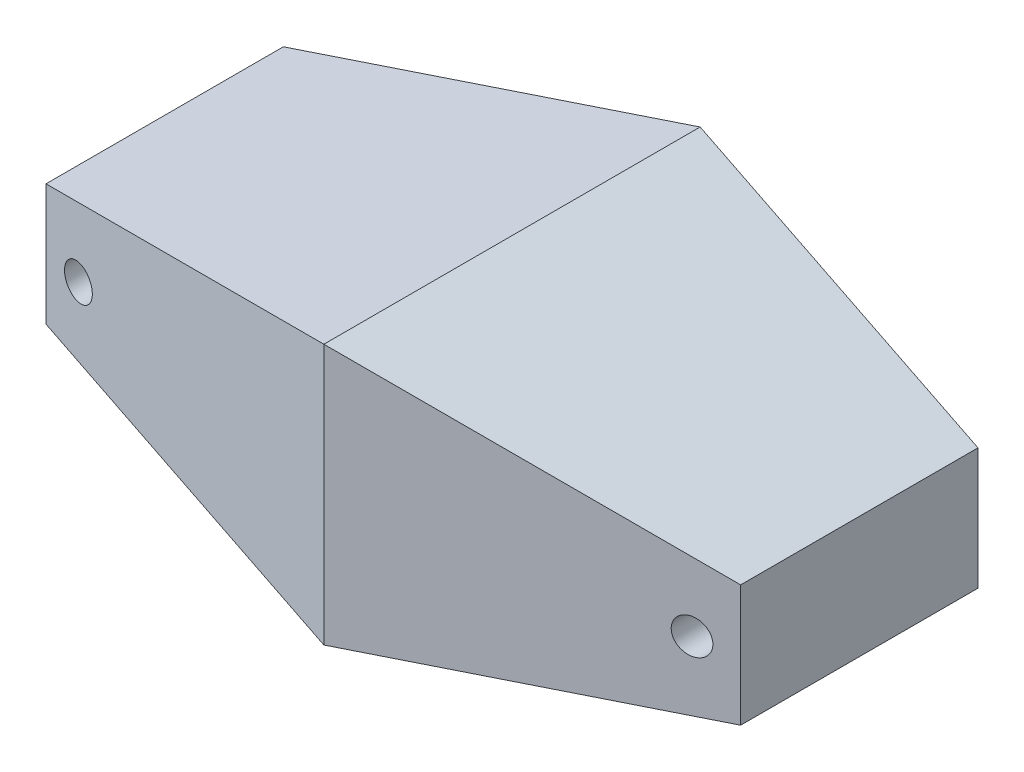
from build123d import *

# Parameters (mm, degrees)
SKETCH1_W           = 120
SKETCH1_H           = 45
BOSS_EXTRUDE1_DEPTH = 65
CUT_EXTRUDE1_DEPTH  = 65
CUT_EXTRUDE2_DEPTH  = 65
SKETCH4_R           = 3
CUT_EXTRUDE3_DEPTH  = 92.275681318


with BuildPart() as part:
    # Sketch1 → Boss-Extrude1 (new body)
    with BuildSketch(Plane.XY):
        Rectangle(SKETCH1_W, SKETCH1_H)
    extrude(amount=BOSS_EXTRUDE1_DEPTH)

    # Sketch2 → Cut-Extrude1 (cut)
    with BuildSketch(Plane(origin=(0, 22.5, 0), x_dir=(1, 0, 0), z_dir=(0, 1, 0))):
        Polygon((-60, -12), (0, 0), (-60, 0), align=None)
        Polygon((60, 0), (0, 0), (60, -12), align=None)
        Polygon((60, -65), (60, -53), (0, -65), align=None)
        Polygon((0, -65), (-60, -53), (-60, -65), align=None)
    extrude(amount=-CUT_EXTRUDE1_DEPTH, mode=Mode.SUBTRACT)

    # Sketch3 → Cut-Extrude2 (cut)
    with BuildSketch(Plane.XY):
        Polygon((-60, 22.5), (0, 22.5), (-60, 10.5), align=None)
        Polygon((60, 22.5), (60, 10.5), (0, 22.5), align=None)
        Polygon((60, -22.5), (0, -22.5), (60, -10.5), align=None)
        Polygon((-60, -10.5), (-60, -22.5), (0, -22.5), align=None)
    extrude(amount=CUT_EXTRUDE2_DEPTH, mode=Mode.SUBTRACT)

    # Sketch4 → Cut-Extrude3 (cut, through all)
    with BuildSketch(Plane.XY):
        with Locations(Location((-53, 0, 0), (0, 0, 180))):
            Circle(SKETCH4_R)
        with Locations(Location((53, 0, 0), (0, 0, 180))):
            Circle(SKETCH4_R)
    extrude(amount=CUT_EXTRUDE3_DEPTH, mode=Mode.SUBTRACT)


solid = part.part
